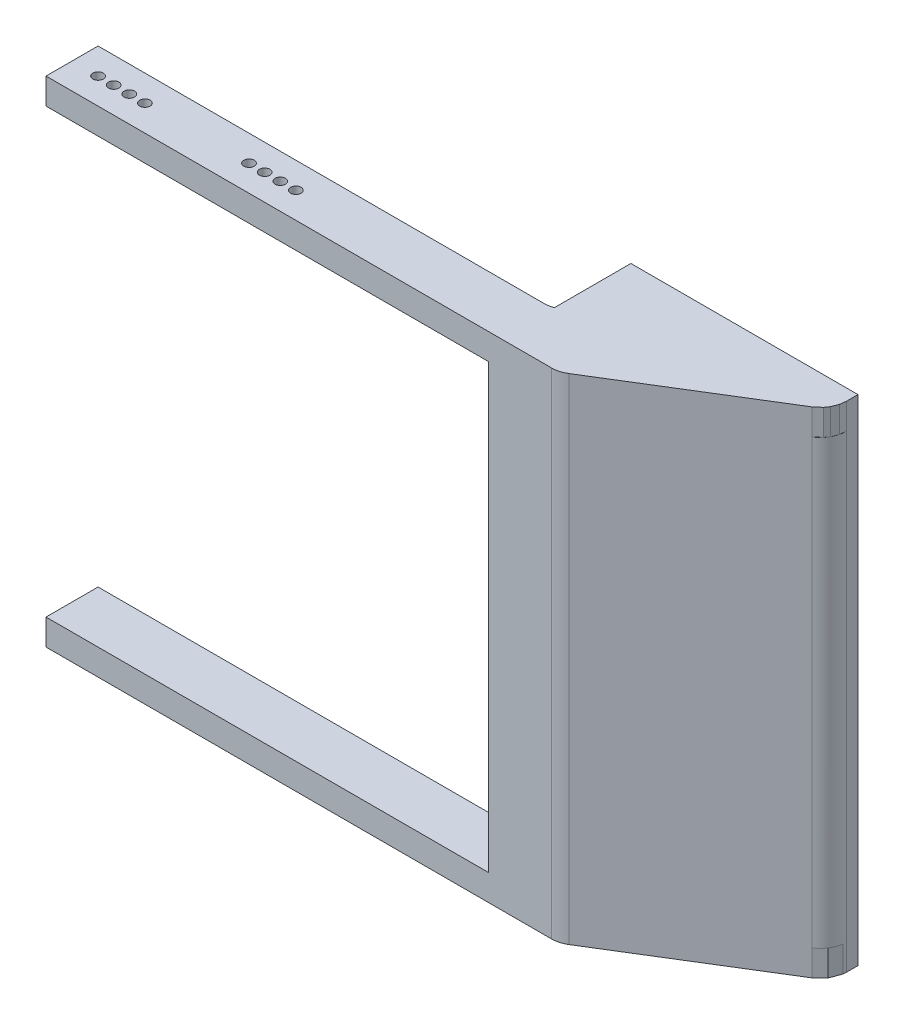
from build123d import *

# Parameters (mm, degrees)
BOSS_EXTRUDE3_DEPTH                  = 95
FILLET8_R                            = 5
FILLET9_R                            = 5
FILLET10_R                           = 5
ESQUISSE3_W                          = 30
ESQUISSE3_H                          = 85
ENL_V_MAT_EXTRU_1_DEPTH              = 122.963109328
ESQUISSE5_W                          = 10
ESQUISSE5_H                          = 60
ENL_V_MAT_EXTRU_2_DEPTH              = 122.963109328
ESQUISSE14_W                         = 10
ESQUISSE14_H                         = 25
ENL_V_MAT_EXTRU_7_DEPTH              = 122.963109328
ESQUISSE15_W                         = 30
ESQUISSE15_H                         = 85
ENL_V_MAT_EXTRU_8_DEPTH              = 122.963109328
ESQUISSE21_W                         = 15
ESQUISSE21_H                         = 85
ENL_V_MAT_EXTRU_9_DEPTH              = 122.963109328
ESQUISSE61_W                         = 43.670119933
ESQUISSE61_H                         = 20.938302955
BOSS_EXTRU_3_DEPTH                   = 5
ENL_V_MAT_EXTRU_18_DEPTH             = 5
ESQUISSE69_W                         = 43.623857554
ESQUISSE69_H                         = 17.142891977
BOSS_EXTRU_4_DEPTH                   = 5
ENL_V_MAT_EXTRU_21_DEPTH             = 10
BOSS_EXTRU_7_DEPTH                   = 17
ENL_V_MAT_EXTRU_25_REACH             = 122.865
ENL_V_MAT_EXTRU_25_DIRECTION_2_DEPTH = 121.865309224
BOSS_EXTRU_10_DEPTH                  = 86
ESQUISSE84_R                         = 1
ENL_V_MAT_EXTRU_26_DEPTH             = 120.791485603


with BuildPart() as part:
    # Sketch1 → Boss-Extrude3 (new body)
    with BuildSketch(Plane(origin=(0, 0, 0), x_dir=(1, 0, 0), z_dir=(0, 1, 0))):
        Polygon((-75, 0), (-75, 10), (24.166666667, 10), (12.5, 20), (12.5, 25), (30, 10), (55.980762114, 25), (55.980762114, 20), (28.449754988, 3.036452995), (23.521740286, 0), align=None)
    extrude(amount=BOSS_EXTRUDE3_DEPTH)

    # Fillet8
    fillet8_edges = [part.edges().sort_by_distance(p)[0] for p in [
        (24.166666667, 47.5, -10),
    ]]
    fillet(fillet8_edges, radius=FILLET8_R)

    # Fillet9
    fillet9_edges = [part.edges().sort_by_distance(p)[0] for p in [
        (55.980762114, 47.5, -20),
        (12.5, 47.5, -20),
    ]]
    fillet(fillet9_edges, radius=FILLET9_R)

    # Fillet10
    fillet10_edges = [part.edges().sort_by_distance(p)[0] for p in [
        (23.521740286, 47.5, 0),
    ]]
    fillet(fillet10_edges, radius=FILLET10_R)

    # Esquisse3 → Enlèv. mat.-Extru.1 (cut, through all)
    with BuildSketch(Plane(origin=(0, 0, -10), x_dir=(-1, 0, 0), z_dir=(0, 0, -1))):
        with Locations((60, 47.5)):
            Rectangle(ESQUISSE3_W, ESQUISSE3_H)
    extrude(amount=-ENL_V_MAT_EXTRU_1_DEPTH, mode=Mode.SUBTRACT)

    # Esquisse5 → Enlèv. mat.-Extru.2 (cut, through all)
    with BuildSketch(Plane(origin=(0, 0, -10), x_dir=(-1, 0, 0), z_dir=(0, 0, -1))):
        with Locations((40, 35)):
            Rectangle(ESQUISSE5_W, ESQUISSE5_H)
    extrude(amount=-ENL_V_MAT_EXTRU_2_DEPTH, mode=Mode.SUBTRACT)

    # Esquisse14 → Enlèv. mat.-Extru.7 (cut, through all)
    with BuildSketch(Plane(origin=(0, 0, -10), x_dir=(-1, 0, 0), z_dir=(0, 0, -1))):
        with Locations((40, 77.5)):
            Rectangle(ESQUISSE14_W, ESQUISSE14_H)
    extrude(amount=-ENL_V_MAT_EXTRU_7_DEPTH, mode=Mode.SUBTRACT)

    # Esquisse15 → Enlèv. mat.-Extru.8 (cut, through all)
    with BuildSketch(Plane(origin=(0, 0, -10), x_dir=(-1, 0, 0), z_dir=(0, 0, -1))):
        with Locations((20, 47.5)):
            Rectangle(ESQUISSE15_W, ESQUISSE15_H)
    extrude(amount=-ENL_V_MAT_EXTRU_8_DEPTH, mode=Mode.SUBTRACT)

    # Esquisse21 → Enlèv. mat.-Extru.9 (cut, through all)
    with BuildSketch(Plane(origin=(0, 0, -10), x_dir=(-1, 0, 0), z_dir=(0, 0, -1))):
        with Locations((-2.5, 47.5)):
            Rectangle(ESQUISSE21_W, ESQUISSE21_H)
    extrude(amount=-ENL_V_MAT_EXTRU_9_DEPTH, mode=Mode.SUBTRACT)

    # Esquisse61 → Boss.-Extru.3 (add)
    with BuildSketch(Plane(origin=(0, 0, 0), x_dir=(1, 0, 0), z_dir=(0, 1, 0))):
        with Locations((34.105579197, 14.530848522)):
            Rectangle(ESQUISSE61_W, ESQUISSE61_H)
    extrude(amount=BOSS_EXTRU_3_DEPTH)

    # Esquisse63 → Enlèv. mat.-Extru.18 (cut)
    with BuildSketch(Plane(origin=(0, 5, 0), x_dir=(1, 0, 0), z_dir=(0, 1, 0))):
        Polygon((55.940639163, 22.159973494), (55.183036705, 20.082720902), (53.603647545, 18.535313491), (30.113675938, 4.061697045), (55.940639163, 4.061697045), align=None)
    extrude(amount=-ENL_V_MAT_EXTRU_18_DEPTH, mode=Mode.SUBTRACT)

    # Esquisse69 → Boss.-Extru.4 (add)
    with BuildSketch(Plane(origin=(0, 95, 0), x_dir=(1, 0, 0), z_dir=(0, 1, 0))):
        with Locations((34.168833337, 16.428554012)):
            Rectangle(ESQUISSE69_W, ESQUISSE69_H)
    extrude(amount=-BOSS_EXTRU_4_DEPTH)

    # Esquisse71 → Enlèv. mat.-Extru.21 (cut)
    with BuildSketch(Plane.XZ.offset(-90)):
        Polygon((55.980762114, -22.792128264), (55.826118619, -21.558223754), (55.346218971, -20.354345168), (54.812246486, -19.579694996), (53.603647545, -18.535313491), (36.273442327, -7.857108023), (55.980762114, -7.857108023), align=None)
    extrude(amount=-ENL_V_MAT_EXTRU_21_DEPTH, mode=Mode.SUBTRACT)

    # Esquisse77 → Boss.-Extru.7 (add)
    with BuildSketch(Plane(origin=(3.169872981, 0, 5.490381057), x_dir=(-0.8660254037844384, 0, 0.5000000000000004), z_dir=(-0.5000000000000004, 0, -0.8660254037844384))):
        Polygon((-30.980762114, 90), (-40.980762114, 90), (-31.480762114, 5), (-30.980762114, 5), align=None)
    extrude(amount=BOSS_EXTRU_7_DEPTH)

    # Esquisse79 → Enlèv. mat.-Extru.25 (cut, up to next)
    with BuildSketch(Plane(origin=(0, 90, 0), x_dir=(1, 0, 0), z_dir=(0, 1, 0)), mode=Mode.PRIVATE) as enl_v_mat_extru_25_sk1:
        Polygon((21.980762114, 25), (32.886751346, 25), (30.160254038, 29.722431864), align=None)
    enl_v_mat_extru_25_tool1 = extrude(enl_v_mat_extru_25_sk1.sketch, amount=-ENL_V_MAT_EXTRU_25_REACH, mode=Mode.PRIVATE) & part.part
    add(enl_v_mat_extru_25_tool1.solids().sort_by_distance((28.342589, 90, -26.574144))[0], mode=Mode.SUBTRACT)

    # Esquisse79 → Enlèv. mat.-Extru.25 direction 2 (cut)
    with BuildSketch(Plane(origin=(0, 90, 0), x_dir=(1, 0, 0), z_dir=(0, 1, 0))):
        Polygon((21.980762114, 25), (32.886751346, 25), (30.160254038, 29.722431864), align=None)
    extrude(amount=ENL_V_MAT_EXTRU_25_DIRECTION_2_DEPTH, mode=Mode.SUBTRACT)

    # Esquisse80 → Boss.-Extru.10 (add)
    with BuildSketch(Plane(origin=(0, 5, 0), x_dir=(1, 0, 0), z_dir=(0, 1, 0))):
        Polygon((12.5, 25), (30, 10), (21.25, 25), align=None)
    extrude(amount=BOSS_EXTRU_10_DEPTH)

    # Esquisse84 → Enlèv. mat.-Extru.26 (cut, through all)
    with BuildSketch(Plane(origin=(0, 90, 0), x_dir=(-1, 0, 0), z_dir=(0, -1, 0))):
        with Locations(Location((70, 5, 0), (0, 0, 90))):
            Circle(ESQUISSE84_R)
        with Locations(Location((67, 5, 0), (0, 0, 90))):
            Circle(ESQUISSE84_R)
        with Locations(Location((64, 5, 0), (0, 0, 90))):
            Circle(ESQUISSE84_R)
        with Locations(Location((61, 5, 0), (0, 0, 90))):
            Circle(ESQUISSE84_R)
        with Locations(Location((41, 5, 0), (0, 0, 90))):
            Circle(ESQUISSE84_R)
        with Locations(Location((38, 5, 0), (0, 0, 90))):
            Circle(ESQUISSE84_R)
        with Locations(Location((35, 5, 0), (0, 0, 90))):
            Circle(ESQUISSE84_R)
        with Locations(Location((32, 5, 0), (0, 0, 90))):
            Circle(ESQUISSE84_R)
    extrude(amount=-ENL_V_MAT_EXTRU_26_DEPTH, mode=Mode.SUBTRACT)


solid = part.part
